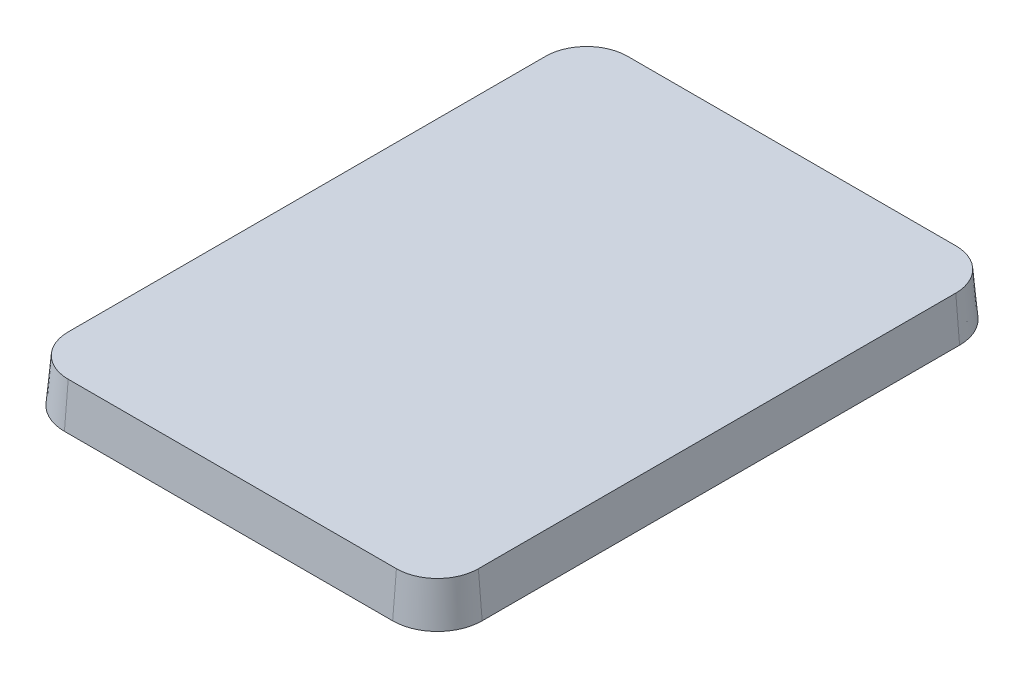
from build123d import *

# Parameters (mm, degrees)
BOSS_EXTRUDE2_DEPTH = 5.8
BOSS_EXTRUDE2_TAPER = 5


with BuildPart() as part:
    # Sketch3 → Boss-Extrude2 (new body)
    with BuildSketch(Plane(origin=(0, 0, 0), x_dir=(1, 0, 0), z_dir=(0, 1, 0))):
        with BuildLine():
            ThreePointArc((-22, 38), (-26.242640687, 36.242640687), (-28, 32))
            Line((-28, 32), (-28, -32))
            ThreePointArc((-28, -32), (-26.242640687, -36.242640687), (-22, -38))
            Line((-22, -38), (22, -38))
            ThreePointArc((22, -38), (26.242640687, -36.242640687), (28, -32))
            Line((28, -32), (28, 32))
            ThreePointArc((28, 32), (26.242640687, 36.242640687), (22, 38))
            Line((22, 38), (-22, 38))
        make_face()
    extrude(amount=BOSS_EXTRUDE2_DEPTH, taper=BOSS_EXTRUDE2_TAPER)


solid = part.part
